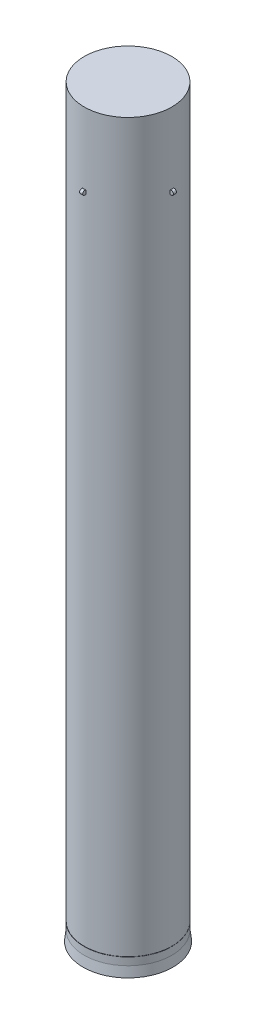
from build123d import *

# Parameters (mm, degrees)
SKETCH2_R           = 10
SKETCH6_R           = 220
BOSS_EXTRUDE1_DEPTH = 160
CIRPATTERN1_COUNT   = 4


with BuildPart() as part:
    # Sketch1 → Revolve1 (revolve)
    with BuildSketch(Plane.XY, mode=Mode.PRIVATE) as revolve1_sk:
        Polygon((0, 76500), (4500, 76500), (4500, 1000), (4620, 0), (4300, 0), (4300, 1500), (4300, 73000), (0, 75000), align=None)
    revolve(revolve1_sk.sketch.rotate(Axis((0, 0, 0), (0, 1, 0)), 90), axis=Axis((0, 0, 0), (0, 1, 0)))

    # Sketch2 → Revolve2 (revolve)
    with BuildSketch(Plane.XY, mode=Mode.PRIVATE) as revolve2_sk:
        with Locations((4506, 1800)):
            Circle(SKETCH2_R)
    revolve(revolve2_sk.sketch.rotate(Axis((0, 0, 0), (0, 1, 0)), 90), axis=Axis((0, 0, 0), (0, 1, 0)))

    # Sketch6 → Boss-Extrude1 (add, symmetric)
    with BuildSketch(Plane.XY):
        with Locations((4600, 69000)):
            Circle(SKETCH6_R)
    boss_extrude1 = extrude(amount=BOSS_EXTRUDE1_DEPTH, both=True)

    # CirPattern1: Boss-Extrude1 ×4 about axis
    cirpattern1_axis = Axis((0, 0, 0), (0, 1, 0))
    for i in range(1, CIRPATTERN1_COUNT):
        add(boss_extrude1.rotate(cirpattern1_axis, i * 360 / CIRPATTERN1_COUNT))


solid = part.part
